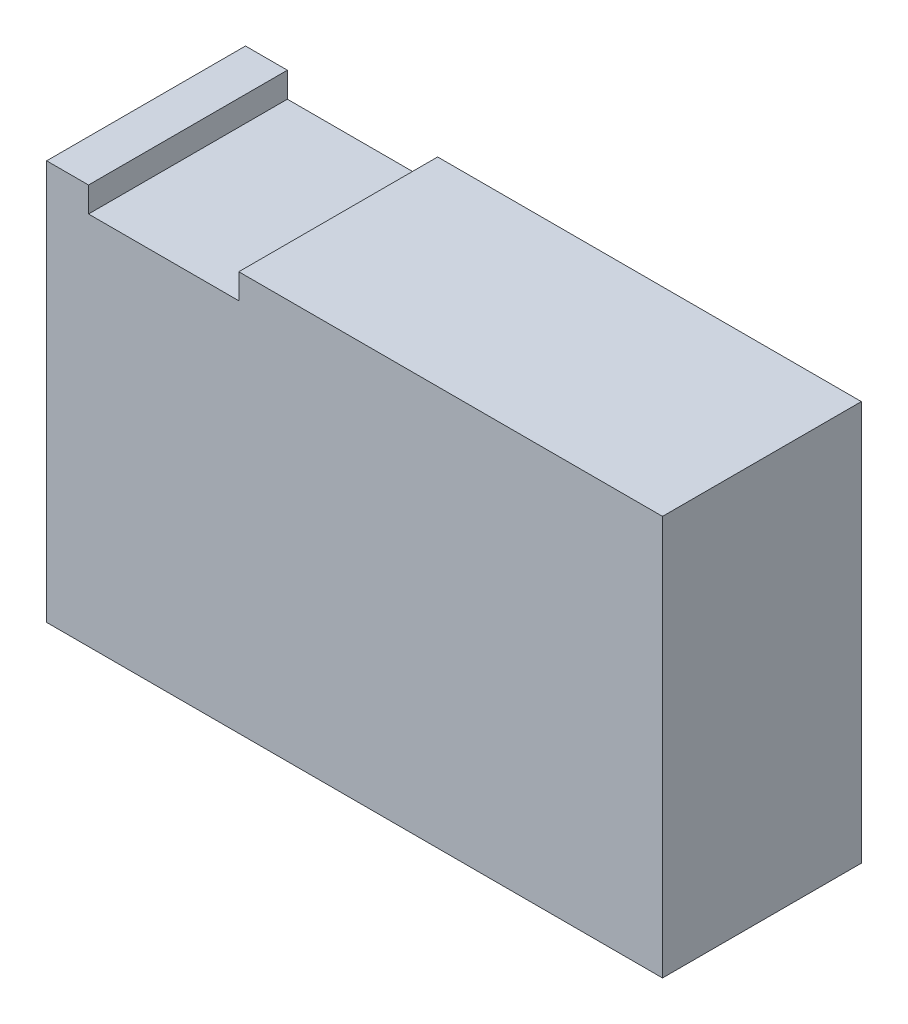
from build123d import *

# Parameters (mm, degrees)
SKETCH_200_W        = 62.5
SKETCH_200_H        = 20.18
EXTRUDE_1_DEPTH     = 40.57
SKETCH_6_W          = 15.25
SKETCH_6_H          = 20.18
CUT_EXTRUDE_1_DEPTH = 2.55


with BuildPart() as part:
    # Sketch 200 → Бобышка-Вытянуть1 (new body)
    with BuildSketch(Plane(origin=(0, 0, 0), x_dir=(1, 0, 0), z_dir=(0, 1, 0))):
        Rectangle(SKETCH_200_W, SKETCH_200_H)
    extrude(amount=EXTRUDE_1_DEPTH)

    # Эскиз6 → Вырез-Вытянуть1 (cut)
    with BuildSketch(Plane(origin=(0, 40.57, 0), x_dir=(1, 0, 0), z_dir=(0, 1, 0))):
        with Locations((-19.375, 0)):
            Rectangle(SKETCH_6_W, SKETCH_6_H)
    extrude(amount=-CUT_EXTRUDE_1_DEPTH, mode=Mode.SUBTRACT)


solid = part.part
